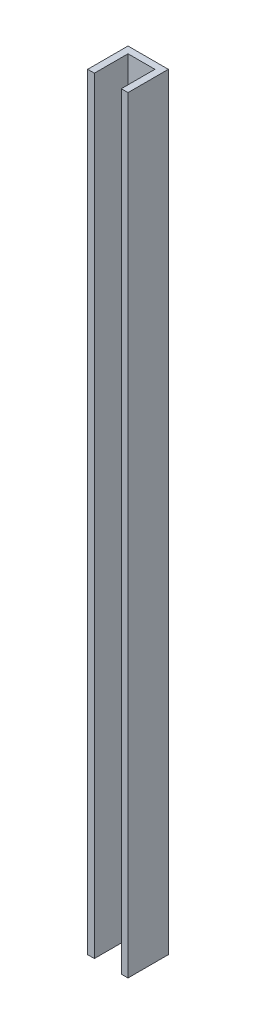
from build123d import *

# Parameters (mm, degrees)
BOSS_EXTRUDE1_DEPTH = 361.95


with BuildPart() as part:
    # Sketch1 → Boss-Extrude1 (new body)
    with BuildSketch(Plane(origin=(0, 0, 0), x_dir=(1, 0, 0), z_dir=(0, 1, 0))):
        Polygon((0, 0), (0, 19.05), (19.05, 19.05), (19.05, 0), (15.875, 0), (15.875, 15.875), (3.175, 15.875), (3.175, 0), align=None)
    extrude(amount=BOSS_EXTRUDE1_DEPTH)


solid = part.part
